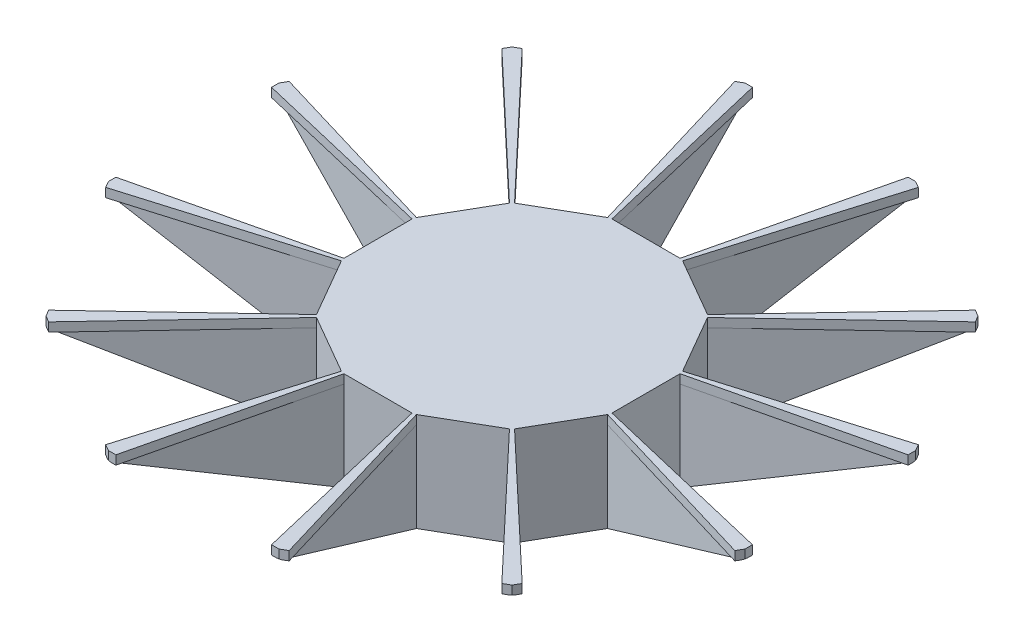
from build123d import *

# Parameters (mm, degrees)
BOSS_EXTRUDE1_DEPTH = 5
SKETCH2_R           = 22.5
BOSS_EXTRUDE2_DEPTH = 50
CUT_EXTRUDE2_REACH  = 258.619
CIRPATTERN1_COUNT   = 12
SKETCH5_R           = 17.5
SKETCH5_R_2         = 10
CUT_EXTRUDE4_DEPTH  = 4
BOSS_EXTRUDE3_START = 30
SKETCH6_R           = 10
BOSS_EXTRUDE3_DEPTH = 30
SKETCH7_R           = 3
CUT_EXTRUDE5_DEPTH  = 28.3
SKETCH8_R           = 1.75
CUT_EXTRUDE6_DEPTH  = 270.993454261


with BuildPart() as part:
    # Sketch1 → Boss-Extrude1 (new body)
    with BuildSketch(Plane(origin=(0, 0, 0), x_dir=(1, 0, 0), z_dir=(0, 1, 0))):
        Polygon((-51.086301889, 175.201860999), (-20.896575472, 74.123378061), (-53.744440679, 55.158654242), (-126.186111471, 131.84296572), (-129.77241336, 129.77241336), (-131.84296572, 126.186111471), (-55.158654242, 53.744440679), (-74.123378061, 20.896575472), (-175.201860999, 51.086301889), (-177.27241336, 47.5), (-177.27241336, 43.358895278), (-74.641016151, 18.96472382), (-74.641016151, -18.96472382), (-177.27241336, -43.358895278), (-177.27241336, -47.5), (-175.201860999, -51.086301889), (-74.123378061, -20.896575472), (-55.158654242, -53.744440679), (-131.84296572, -126.186111471), (-129.77241336, -129.77241336), (-126.186111471, -131.84296572), (-53.744440679, -55.158654242), (-20.896575472, -74.123378061), (-51.086301889, -175.201860999), (-47.5, -177.27241336), (-43.358895278, -177.27241336), (-18.96472382, -74.641016151), (18.96472382, -74.641016151), (43.358895278, -177.27241336), (47.5, -177.27241336), (51.086301889, -175.201860999), (20.896575472, -74.123378061), (53.744440679, -55.158654242), (126.186111471, -131.84296572), (129.77241336, -129.77241336), (131.84296572, -126.186111471), (55.158654242, -53.744440679), (74.123378061, -20.896575472), (175.201860999, -51.086301889), (177.27241336, -47.5), (177.27241336, -43.358895278), (74.641016151, -18.96472382), (74.641016151, 18.96472382), (177.27241336, 43.358895278), (177.27241336, 47.5), (175.201860999, 51.086301889), (74.123378061, 20.896575472), (55.158654242, 53.744440679), (131.84296572, 126.186111471), (129.77241336, 129.77241336), (126.186111471, 131.84296572), (53.744440679, 55.158654242), (20.896575472, 74.123378061), (51.086301889, 175.201860999), (47.5, 177.27241336), (43.358895278, 177.27241336), (18.96472382, 74.641016151), (-18.96472382, 74.641016151), (-43.358895278, 177.27241336), (-47.5, 177.27241336), align=None)
    extrude(amount=BOSS_EXTRUDE1_DEPTH)

    # Sketch2 → Boss-Extrude2 (add)
    # profile 1 of 2: a face of its own
    with BuildSketch(Plane.XZ):
        Polygon((-20.896575472, 74.123378061), (-48.396575472, 176.754775269), (-47.5, 177.27241336), (-46.46472382, 177.27241336), (-18.96472382, 74.641016151), (18.96472382, 74.641016151), (46.46472382, 177.27241336), (47.5, 177.27241336), (48.396575472, 176.754775269), (20.896575472, 74.123378061), (53.744440679, 55.158654242), (128.875837887, 130.29005145), (129.77241336, 129.77241336), (130.29005145, 128.875837887), (55.158654242, 53.744440679), (74.123378061, 20.896575472), (176.754775269, 48.396575472), (177.27241336, 47.5), (177.27241336, 46.46472382), (74.641016151, 18.96472382), (74.641016151, -18.96472382), (177.27241336, -46.46472382), (177.27241336, -47.5), (176.754775269, -48.396575472), (74.123378061, -20.896575472), (55.158654242, -53.744440679), (130.29005145, -128.875837887), (129.77241336, -129.77241336), (128.875837887, -130.29005145), (53.744440679, -55.158654242), (20.896575472, -74.123378061), (48.396575472, -176.754775269), (47.5, -177.27241336), (46.46472382, -177.27241336), (18.96472382, -74.641016151), (-18.96472382, -74.641016151), (-46.46472382, -177.27241336), (-47.5, -177.27241336), (-48.396575472, -176.754775269), (-20.896575472, -74.123378061), (-53.744440679, -55.158654242), (-128.875837887, -130.29005145), (-129.77241336, -129.77241336), (-130.29005145, -128.875837887), (-55.158654242, -53.744440679), (-74.123378061, -20.896575472), (-176.754775269, -48.396575472), (-177.27241336, -47.5), (-177.27241336, -46.46472382), (-74.641016151, -18.96472382), (-74.641016151, 18.96472382), (-177.27241336, 46.46472382), (-177.27241336, 47.5), (-176.754775269, 48.396575472), (-74.123378061, 20.896575472), (-55.158654242, 53.744440679), (-130.29005145, 128.875837887), (-129.77241336, 129.77241336), (-128.875837887, 130.29005145), (-53.744440679, 55.158654242), align=None)
        Polygon((-19.330127019, 72.141016151), (-52.810889132, 52.810889132), (-72.141016151, 19.330127019), (-72.141016151, -19.330127019), (-52.810889132, -52.810889132), (-19.330127019, -72.141016151), (19.330127019, -72.141016151), (52.810889132, -52.810889132), (72.141016151, -19.330127019), (72.141016151, 19.330127019), (52.810889132, 52.810889132), (19.330127019, 72.141016151), align=None, mode=Mode.SUBTRACT)
    # profile 2 of 2: a face of its own
    with BuildSketch(Plane.XZ):
        with Locations(Location((0, 0, 0), (0, 0, 270))):
            Circle(SKETCH2_R)
    extrude(amount=BOSS_EXTRUDE2_DEPTH)

    # Sketch4 → Cut-Extrude2 (cut, up to next)
    with BuildSketch(Plane(origin=(0.7071067811855712, 0, 0.7071067811855722), x_dir=(0.7071067811865479, 0, -0.7071067811865471), z_dir=(0.7071067811865471, 0, 0.7071067811865479)), mode=Mode.PRIVATE) as cut_extrude2_sk1:
        Polygon((-77.006116911, -50), (-183.136497491, 0), (-183.257957802, 0), (-183.257957802, -50), align=None)
    cut_extrude2_tool1 = extrude(cut_extrude2_sk1.sketch, amount=-CUT_EXTRUDE2_REACH, mode=Mode.PRIVATE) & part.part
    # Sketch4 → Cut-Extrude2 (cut, up to next)
    with BuildSketch(Plane(origin=(0.7071067811855712, 0, 0.7071067811855722), x_dir=(0.7071067811865479, 0, -0.7071067811865471), z_dir=(0.7071067811865471, 0, 0.7071067811865479)), mode=Mode.PRIVATE) as cut_extrude2_sk2:
        Polygon((-183.136497491, 0), (-185.006116911, 0.880812549), (-185.006116911, -50), (-183.257957802, -50), (-183.257957802, 0), align=None)
    cut_extrude2_tool2 = extrude(cut_extrude2_sk2.sketch, amount=-CUT_EXTRUDE2_REACH, mode=Mode.PRIVATE) & part.part
    cut_extrude2_1 = cut_extrude2_tool1.solids().sort_by_distance((-103.832006, -33.314303, 105.24622))[0]
    add(cut_extrude2_1, mode=Mode.SUBTRACT)
    cut_extrude2_2 = cut_extrude2_tool2.solids().sort_by_distance((-129.495561, -24.763955, 130.909775))[0]
    add(cut_extrude2_2, mode=Mode.SUBTRACT)
    cut_extrude2 = cut_extrude2_1 + cut_extrude2_2  # Cut-Extrude2 as one shape, for the pattern or mirror that repeats it

    # CirPattern1: Cut-Extrude2 ×12 about axis
    cirpattern1_axis = Axis((0, 0, 0), (0, 1, 0))
    for i in range(1, CIRPATTERN1_COUNT):
        add(cut_extrude2.rotate(cirpattern1_axis, i * 360 / CIRPATTERN1_COUNT), mode=Mode.SUBTRACT)

    # Sketch5 → Cut-Extrude4 (cut)
    with BuildSketch(Plane.XZ.offset(50)):
        with Locations(Location((0, 0, 0), (0, 0, 270))):
            Circle(SKETCH5_R)
        with Locations(Location((0, 0, 0), (0, 0, 270))):
            Circle(SKETCH5_R_2, mode=Mode.SUBTRACT)
    extrude(amount=-CUT_EXTRUDE4_DEPTH, mode=Mode.SUBTRACT)

    # Sketch6 → Boss-Extrude3 (add)
    with BuildSketch(Plane.XZ.offset(50).offset(BOSS_EXTRUDE3_START)):
        with Locations(Location((0, 0, 0), (0, 0, 270))):
            Circle(SKETCH6_R)
    extrude(amount=-BOSS_EXTRUDE3_DEPTH)

    # Sketch7 → Cut-Extrude5 (cut)
    with BuildSketch(Plane.XZ.offset(80)):
        with Locations(Location((0, 0, 0), (0, 0, 270))):
            Circle(SKETCH7_R)
    extrude(amount=-CUT_EXTRUDE5_DEPTH, mode=Mode.SUBTRACT)

    # Sketch8 → Cut-Extrude6 (cut, through all)
    with BuildSketch(Plane(origin=(0, 0, -10), x_dir=(-1, 0, 0), z_dir=(0, 0, -1))):
        with Locations((0, -59.7)):
            Circle(SKETCH8_R)
    extrude(amount=-CUT_EXTRUDE6_DEPTH, mode=Mode.SUBTRACT)


solid = part.part
